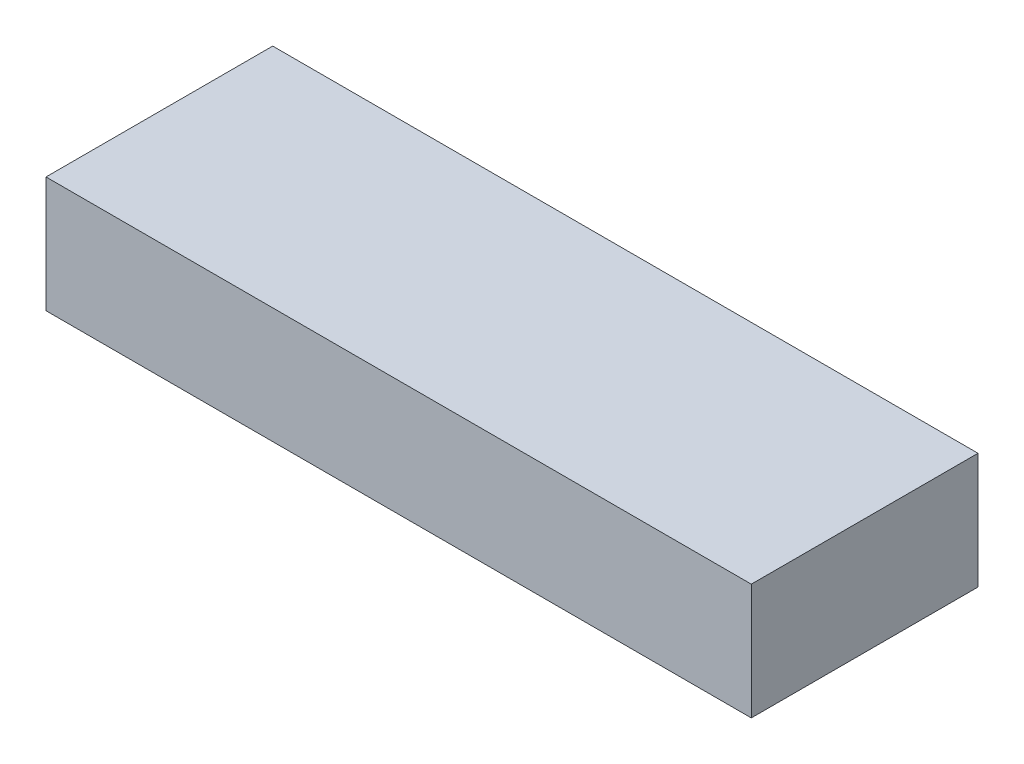
from build123d import *

# Parameters (mm, degrees)
SKETCH1_W           = 140
SKETCH1_H           = 45
BOSS_EXTRUDE1_DEPTH = 23


with BuildPart() as part:
    # Sketch1 → Boss-Extrude1 (new body)
    with BuildSketch(Plane(origin=(0, 0, 0), x_dir=(1, 0, 0), z_dir=(0, 1, 0))):
        Rectangle(SKETCH1_W, SKETCH1_H)
    extrude(amount=BOSS_EXTRUDE1_DEPTH)


solid = part.part
